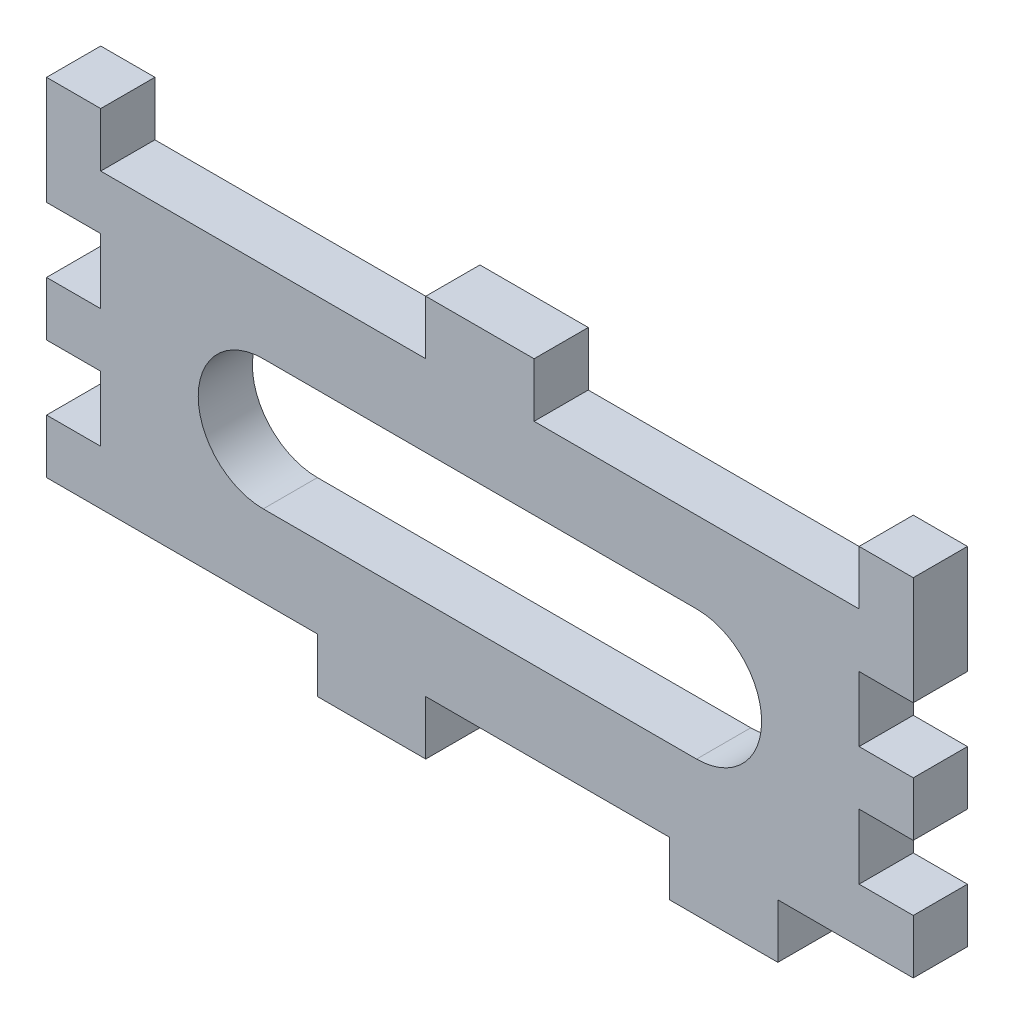
from build123d import *

# Parameters (mm, degrees)
ESQUISSE1_W        = 80
ESQUISSE1_H        = 27
BOSS_EXTRU_1_DEPTH = 5
ESQUISSE2_W        = 5
ESQUISSE2_H        = 6
CR_NEAUX_DEPTH     = 5
ESQUISSE3_W        = 5
ESQUISSE3_H        = 5
ESQUISSE3_W_2      = 10
CR_NEAUX_2_DEPTH   = 5


with BuildPart() as part:
    # Esquisse1 → Boss.-Extru.1 (new body)
    with BuildSketch(Plane.XY):
        with Locations((-98.983627477, 156.921111622)):
            Rectangle(ESQUISSE1_W, ESQUISSE1_H)
    extrude(amount=-BOSS_EXTRU_1_DEPTH)

    # Esquisse2 → Cr_neaux (cut)
    with BuildSketch(Plane.XY):
        with BuildLine():
            Line((-118.983627477, 162.921111622), (-78.983627477, 162.921111622))
            ThreePointArc((-78.983627477, 162.921111622), (-72.983627477, 156.921111622), (-78.983627477, 150.921111622))
            Line((-78.983627477, 150.921111622), (-118.983627477, 150.921111622))
            ThreePointArc((-118.983627477, 150.921111622), (-124.983627477, 156.921111622), (-118.983627477, 162.921111622))
        make_face()
        with Locations((-61.483627477, 162.421111622)):
            Rectangle(ESQUISSE2_W, ESQUISSE2_H)
        with Locations((-61.483627477, 151.421111622)):
            Rectangle(ESQUISSE2_W, ESQUISSE2_H)
        with Locations((-136.483627477, 151.421111622)):
            Rectangle(ESQUISSE2_W, ESQUISSE2_H)
        with Locations((-136.483627477, 162.421111622)):
            Rectangle(ESQUISSE2_W, ESQUISSE2_H)
    extrude(amount=-CR_NEAUX_DEPTH, mode=Mode.SUBTRACT)

    # Esquisse3 → Cr_neaux 2 (add)
    with BuildSketch(Plane.XY):
        with Locations((-61.483627477, 172.921111622)):
            Rectangle(ESQUISSE3_W, ESQUISSE3_H)
        with Locations((-76.483627477, 140.921111622)):
            Rectangle(ESQUISSE3_W_2, ESQUISSE3_H)
        with Locations((-108.983627477, 140.921111622)):
            Rectangle(ESQUISSE3_W_2, ESQUISSE3_H)
        with Locations((-98.983627477, 172.921111622)):
            Rectangle(ESQUISSE3_W_2, ESQUISSE3_H)
        with Locations((-136.483627477, 172.921111622)):
            Rectangle(ESQUISSE3_W, ESQUISSE3_H)
    extrude(amount=-CR_NEAUX_2_DEPTH)


solid = part.part
